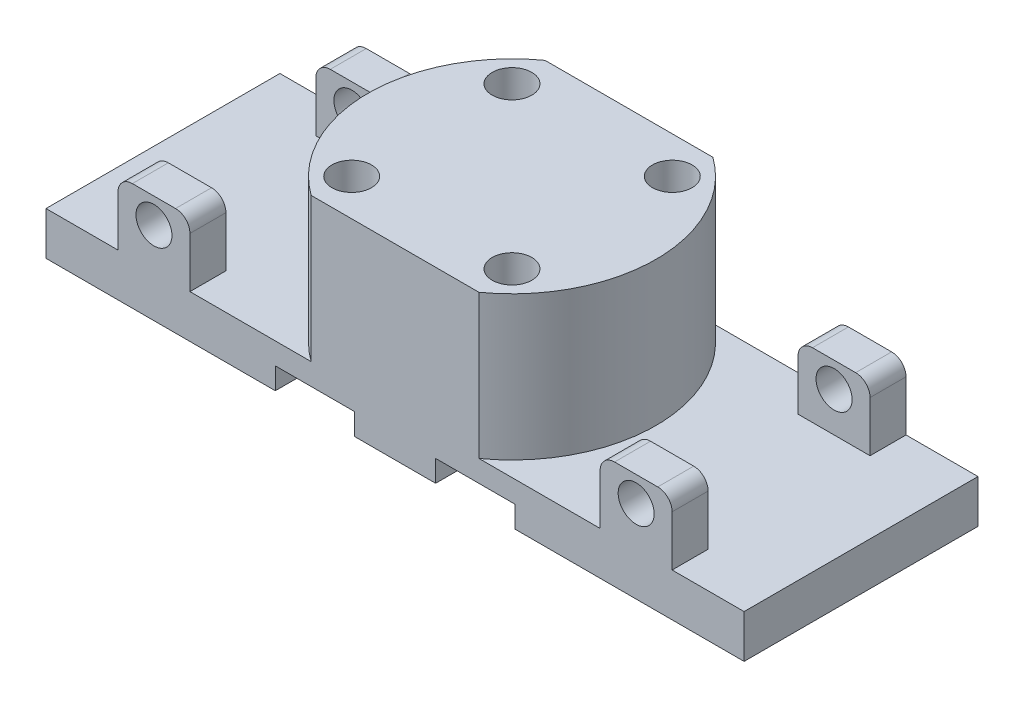
from build123d import *

# Parameters (mm, degrees)
SKETCH1_W                                           = 97
SKETCH1_H                                           = 32.5
BOSS_EXTRUDE1_DEPTH                                 = 6
SKETCH5_R                                           = 20
BOSS_EXTRUDE5_DEPTH                                 = 20
CBORE_FOR_M5_HEX_SOCKET_HEAD_CAP_SCREW1_D           = 5.5
CBORE_FOR_M5_HEX_SOCKET_HEAD_CAP_SCREW1_CBORE_D     = 10
CBORE_FOR_M5_HEX_SOCKET_HEAD_CAP_SCREW1_CBORE_DEPTH = 5.9
SKETCH16_R                                          = 2.5
BOSS_EXTRUDE6_DEPTH                                 = 5
BOSS_EXTRUDE7_START                                 = -27.5
SKETCH16_2_R                                        = 2.5
BOSS_EXTRUDE7_DEPTH                                 = 5
SKETCH17_R                                          = 5
CUT_EXTRUDE3_DEPTH                                  = 3
SKETCH18_R                                          = 5
SKETCH18_R_2                                        = 2.75
BOSS_EXTRUDE8_DEPTH                                 = 2.9
CUT_EXTRUDE4_DEPTH                                  = 20


with BuildPart() as part:
    # Sketch1 → Boss-Extrude1 (new body)
    with BuildSketch(Plane(origin=(0, 0, 0), x_dir=(1, 0, 0), z_dir=(0, 1, 0))):
        with Locations((48.5, 16.25)):
            Rectangle(SKETCH1_W, SKETCH1_H)
    extrude(amount=BOSS_EXTRUDE1_DEPTH)

    # Sketch5 → Boss-Extrude5 (add)
    with BuildSketch(Plane(origin=(0, 6, 0), x_dir=(1, 0, 0), z_dir=(0, 1, 0))):
        with Locations(Location((48.5, 16.25, 0), (0, 0, 54.340912304))):
            Circle(SKETCH5_R)
    extrude(amount=BOSS_EXTRUDE5_DEPTH)

    # CBORE for M5 Hex Socket Head Cap Screw1 (through all)
    with Locations(Plane.XZ):
        with Locations((37.363068196, -5.113068196), (59.636931804, -5.113068196), (59.636931804, -27.386931804), (37.363068196, -27.386931804)):
            CounterBoreHole(CBORE_FOR_M5_HEX_SOCKET_HEAD_CAP_SCREW1_D / 2, CBORE_FOR_M5_HEX_SOCKET_HEAD_CAP_SCREW1_CBORE_D / 2, CBORE_FOR_M5_HEX_SOCKET_HEAD_CAP_SCREW1_CBORE_DEPTH)

    # Sketch16 → Boss-Extrude6 (add)
    # profile 1 of 2: a face of its own
    with BuildSketch(Plane.XY):
        with BuildLine():
            Line((87, 6), (77, 6))
            Line((77, 6), (77, 13))
            ThreePointArc((77, 13), (77.585786438, 14.414213562), (79, 15))
            Line((79, 15), (85, 15))
            ThreePointArc((85, 15), (86.414213562, 14.414213562), (87, 13))
            Line((87, 13), (87, 6))
        make_face()
        with Locations(Location((82, 11.5, 0), (0, 0, 180))):
            Circle(SKETCH16_R, mode=Mode.SUBTRACT)
    # profile 2 of 2: a face of its own
    with BuildSketch(Plane.XY):
        with BuildLine():
            Line((10, 6), (10, 13))
            ThreePointArc((10, 13), (10.585786438, 14.414213562), (12, 15))
            Line((12, 15), (18, 15))
            ThreePointArc((18, 15), (19.414213562, 14.414213562), (20, 13))
            Line((20, 13), (20, 6))
            Line((20, 6), (10, 6))
        make_face()
        with Locations((15, 11.5)):
            Circle(SKETCH16_R, mode=Mode.SUBTRACT)
    extrude(amount=-BOSS_EXTRUDE6_DEPTH)

    # Sketch16<2> → Boss-Extrude7 (add)
    # profile 1 of 2: a face of its own
    with BuildSketch(Plane.XY.offset(BOSS_EXTRUDE7_START)):
        with BuildLine():
            Line((87, 6), (77, 6))
            Line((77, 6), (77, 13))
            ThreePointArc((77, 13), (77.585786438, 14.414213562), (79, 15))
            Line((79, 15), (85, 15))
            ThreePointArc((85, 15), (86.414213562, 14.414213562), (87, 13))
            Line((87, 13), (87, 6))
        make_face()
        with Locations(Location((82, 11.5, 0), (0, 0, 180))):
            Circle(SKETCH16_2_R, mode=Mode.SUBTRACT)
    # profile 2 of 2: a face of its own
    with BuildSketch(Plane.XY.offset(BOSS_EXTRUDE7_START)):
        with BuildLine():
            Line((10, 6), (10, 13))
            ThreePointArc((10, 13), (10.585786438, 14.414213562), (12, 15))
            Line((12, 15), (18, 15))
            ThreePointArc((18, 15), (19.414213562, 14.414213562), (20, 13))
            Line((20, 13), (20, 6))
            Line((20, 6), (10, 6))
        make_face()
        with Locations((15, 11.5)):
            Circle(SKETCH16_2_R, mode=Mode.SUBTRACT)
    extrude(amount=-BOSS_EXTRUDE7_DEPTH)

    # Sketch17 → Cut-Extrude3 (cut)
    # profile 1 of 8: a face of its own
    with BuildSketch(Plane.XZ):
        with BuildLine():
            ThreePointArc((42.863068196, -27.386931804), (37.363068196, -21.886931804), (31.863068196, -27.386931804))
            Line((31.863068196, -27.386931804), (31.863068196, -32.5))
            Line((31.863068196, -32.5), (42.863068196, -32.5))
            Line((42.863068196, -32.5), (42.863068196, -27.386931804))
        make_face()
        with Locations(Location((37.363068196, -27.386931804, 0), (0, 0, 270))):
            Circle(SKETCH17_R, mode=Mode.SUBTRACT)
    # profile 2 of 8: a face of its own
    with BuildSketch(Plane.XZ):
        with BuildLine():
            Line((54.136931804, -27.386931804), (54.136931804, -32.5))
            Line((54.136931804, -32.5), (65.136931804, -32.5))
            Line((65.136931804, -32.5), (65.136931804, -27.386931804))
            ThreePointArc((65.136931804, -27.386931804), (59.636931804, -21.886931804), (54.136931804, -27.386931804))
        make_face()
        with Locations(Location((59.636931804, -27.386931804, 0), (0, 0, 270))):
            Circle(SKETCH17_R, mode=Mode.SUBTRACT)
    # profile 3 of 8: a face of its own
    with BuildSketch(Plane.XZ):
        with BuildLine():
            Line((54.136931804, 0), (54.136931804, -5.113068196))
            ThreePointArc((54.136931804, -5.113068196), (59.636931804, -10.613068196), (65.136931804, -5.113068196))
            Line((65.136931804, -5.113068196), (65.136931804, 0))
            Line((65.136931804, 0), (54.136931804, 0))
        make_face()
        with Locations(Location((59.636931804, -5.113068196, 0), (0, 0, 270))):
            Circle(SKETCH17_R, mode=Mode.SUBTRACT)
    # profile 4 of 8: a face of its own
    with BuildSketch(Plane.XZ):
        with BuildLine():
            Line((42.863068196, -5.113068196), (42.863068196, 0))
            Line((42.863068196, 0), (31.863068196, 0))
            Line((31.863068196, 0), (31.863068196, -5.113068196))
            ThreePointArc((31.863068196, -5.113068196), (37.363068196, -10.613068196), (42.863068196, -5.113068196))
        make_face()
        with Locations(Location((37.363068196, -5.113068196, 0), (0, 0, 270))):
            Circle(SKETCH17_R, mode=Mode.SUBTRACT)
    # profile 5 of 8: a face of its own
    with BuildSketch(Plane.XZ):
        with Locations(Location((37.363068196, -27.386931804, 0), (0, 0, 270))):
            Circle(SKETCH17_R)
    # profile 6 of 8: a face of its own
    with BuildSketch(Plane.XZ):
        with Locations(Location((59.636931804, -27.386931804, 0), (0, 0, 270))):
            Circle(SKETCH17_R)
    # profile 7 of 8: a face of its own
    with BuildSketch(Plane.XZ):
        with Locations(Location((59.636931804, -5.113068196, 0), (0, 0, 270))):
            Circle(SKETCH17_R)
    # profile 8 of 8: a face of its own
    with BuildSketch(Plane.XZ):
        with Locations(Location((37.363068196, -5.113068196, 0), (0, 0, 270))):
            Circle(SKETCH17_R)
    extrude(amount=-CUT_EXTRUDE3_DEPTH, mode=Mode.SUBTRACT)

    # Sketch18 → Boss-Extrude8 (add)
    # profile 1 of 4: a face of its own
    with BuildSketch(Plane.XZ.offset(-5.9)):
        with Locations((37.363068196, -27.386931804)):
            Circle(SKETCH18_R)
        with Locations(Location((37.363068196, -27.386931804, 0), (0, 0, 270))):
            Circle(SKETCH18_R_2, mode=Mode.SUBTRACT)
    # profile 2 of 4: a face of its own
    with BuildSketch(Plane.XZ.offset(-5.9)):
        with Locations((37.363068196, -5.113068196)):
            Circle(SKETCH18_R)
        with Locations(Location((37.363068196, -5.113068196, 0), (0, 0, 270))):
            Circle(SKETCH18_R_2, mode=Mode.SUBTRACT)
    # profile 3 of 4: a face of its own
    with BuildSketch(Plane.XZ.offset(-5.9)):
        with Locations((59.636931804, -5.113068196)):
            Circle(SKETCH18_R)
        with Locations(Location((59.636931804, -5.113068196, 0), (0, 0, 270))):
            Circle(SKETCH18_R_2, mode=Mode.SUBTRACT)
    # profile 4 of 4: a face of its own
    with BuildSketch(Plane.XZ.offset(-5.9)):
        with Locations((59.636931804, -27.386931804)):
            Circle(SKETCH18_R)
        with Locations(Location((59.636931804, -27.386931804, 0), (0, 0, 270))):
            Circle(SKETCH18_R_2, mode=Mode.SUBTRACT)
    extrude(amount=BOSS_EXTRUDE8_DEPTH)

    # Sketch19 → Cut-Extrude4 (cut)
    with BuildSketch(Plane.XZ.offset(-6)):
        with BuildLine():
            Line((36.840776184, 0), (60.159223816, 0))
            ThreePointArc((60.159223816, 0), (48.5, 3.75), (36.840776184, 0))
        make_face()
        with BuildLine():
            Line((60.159223816, -32.5), (36.840776184, -32.5))
            ThreePointArc((36.840776184, -32.5), (48.5, -36.25), (60.159223816, -32.5))
        make_face()
    extrude(amount=-CUT_EXTRUDE4_DEPTH, mode=Mode.SUBTRACT)


solid = part.part
